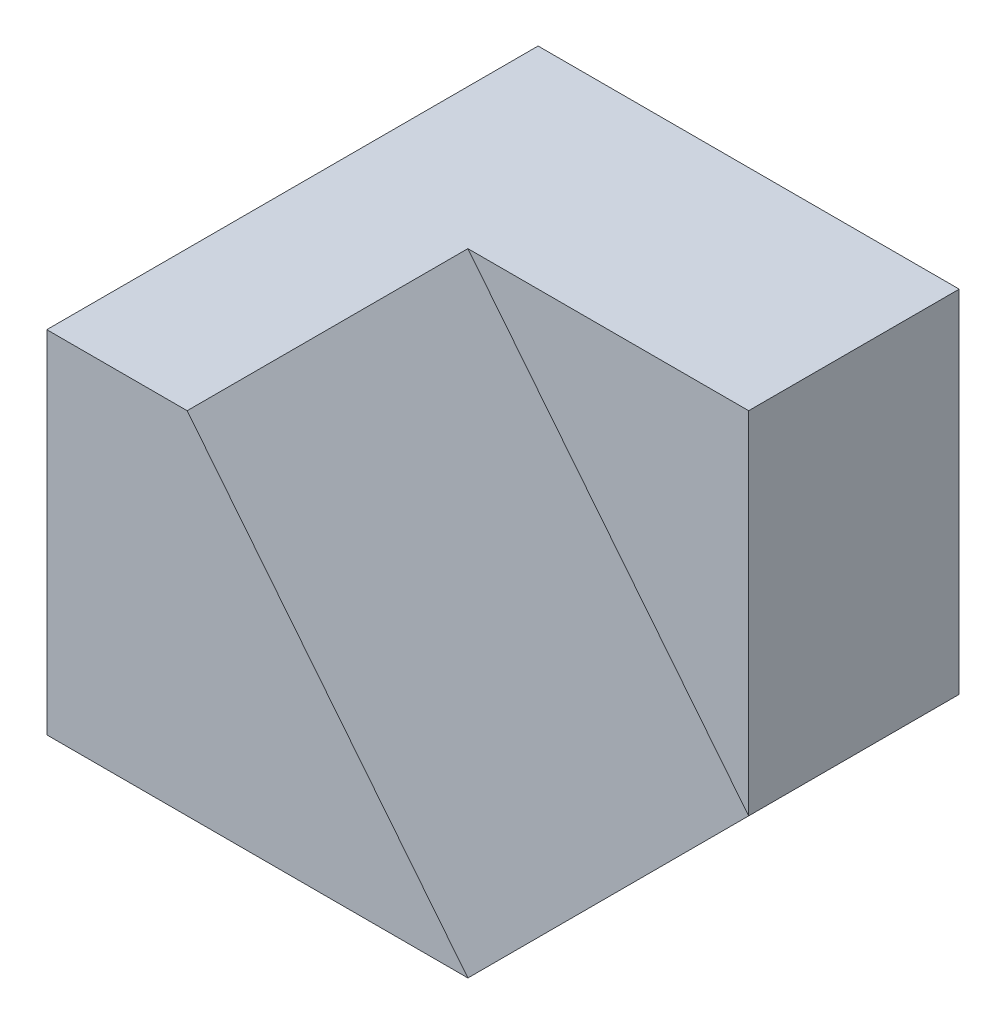
from build123d import *

# Parameters (mm, degrees)
RESSALTO_EXTRUS_O1_DEPTH = 40
ESBO_O2_W                = 60
ESBO_O2_H                = 50
RESSALTO_EXTRUS_O2_DEPTH = 30


with BuildPart() as part:
    # Esboço1 → Ressalto-extrusão1 (new body)
    with BuildSketch(Plane.XY):
        Polygon((0, 0), (60, 0), (20, 50), (0, 50), align=None)
    extrude(amount=RESSALTO_EXTRUS_O1_DEPTH)

    # Esboço2 → Ressalto-extrusão2 (add)
    with BuildSketch(Plane(origin=(0, 0, 0), x_dir=(-1, 0, 0), z_dir=(0, 0, -1))):
        with Locations((-30, 25)):
            Rectangle(ESBO_O2_W, ESBO_O2_H)
    extrude(amount=RESSALTO_EXTRUS_O2_DEPTH)


solid = part.part
